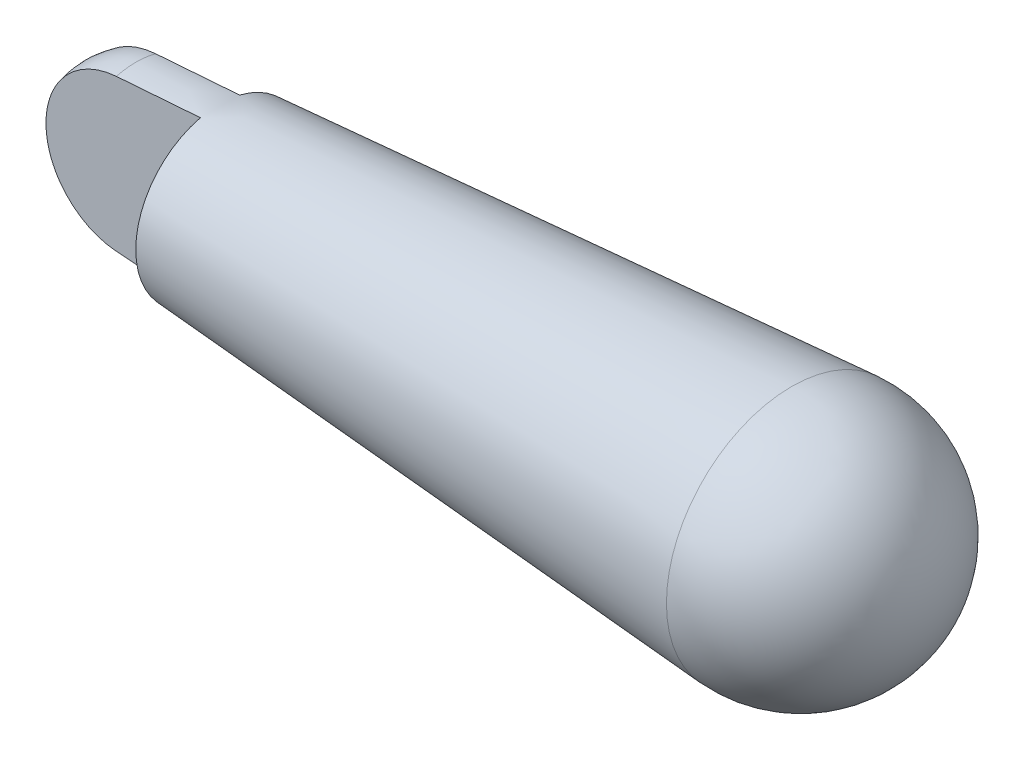
from build123d import *

# Parameters (mm, degrees)
CUT_EXTRUDE2_DEPTH      = 157.48
CUT_EXTRUDE2_DEPTH_BACK = 157.48
SKETCH2_W               = 101.6
SKETCH2_H               = 127


with BuildPart() as part:
    # Sketch1 → Revolve1 (revolve)
    with BuildSketch(Plane.XY):
        with BuildLine():
            Line((-213.36, 0), (213.36, 0))
            Line((213.36, 0), (294.64, 0))
            ThreePointArc((294.64, 0), (268.742984494, 59.490868447), (207.554285714, 81.072387911))
            Line((207.554285714, 81.072387911), (-216.988571429, 50.670242445))
            ThreePointArc((-216.988571429, 50.670242445), (-250.541792779, 34.614365309), (-264.16, 0))
            Line((-264.16, 0), (-213.36, 0))
        make_face()
    revolve(axis=Axis((-213.36, 0, 0), (1, 0, 0)))

    # Sketch2 → Cut-Extrude2 (cut, two sides: drawn at the far end of the back side and taken through both)
    with BuildSketch(Plane(origin=(0, 0, 0), x_dir=(1, 0, 0), z_dir=(0, 1, 0)).offset(-CUT_EXTRUDE2_DEPTH_BACK)):
        with Locations((-213.36, 76.2)):
            Rectangle(SKETCH2_W, SKETCH2_H)
        with Locations((-213.36, -76.2)):
            Rectangle(SKETCH2_W, SKETCH2_H)
    extrude(amount=CUT_EXTRUDE2_DEPTH + CUT_EXTRUDE2_DEPTH_BACK, mode=Mode.SUBTRACT)


solid = part.part
